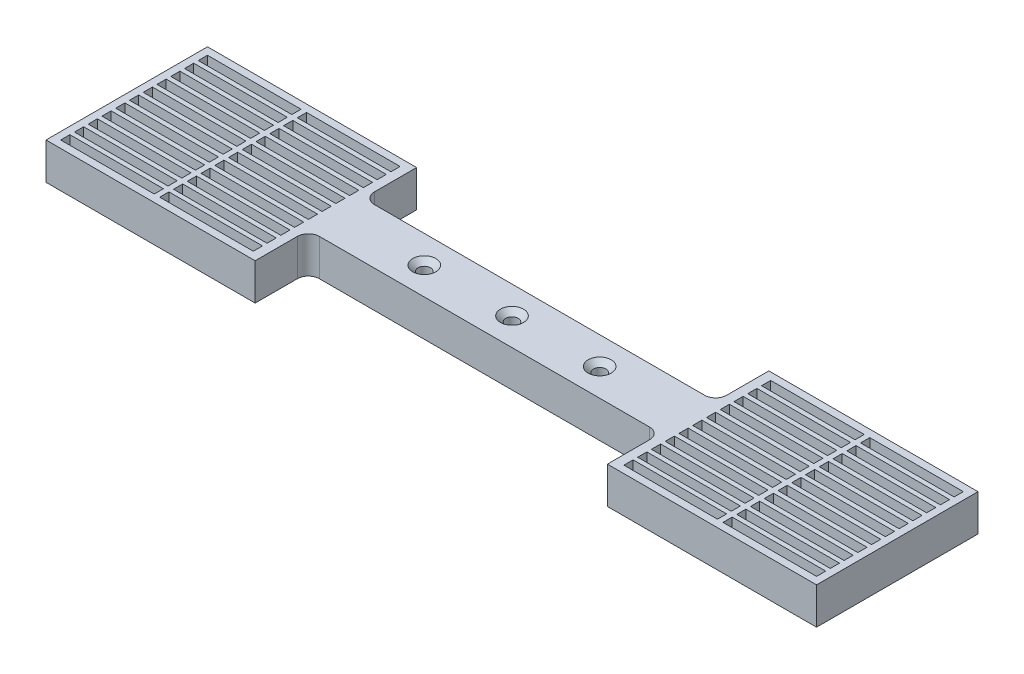
from build123d import *

# Parameters (mm, degrees)
BOSS_EXTRUDE1_DEPTH                             = 10
CUT_EXTRUDE1_REACH                              = 109.745
SKETCH2_W                                       = 25.5
SKETCH2_H                                       = 2.5
LPATTERN1_COUNT                                 = 6
LPATTERN1_PITCH                                 = 3.75
LPATTERN1_COL_COUNT                             = 6
LPATTERN1_COL_PITCH                             = 3.75
LPATTERN2_COUNT                                 = 2
LPATTERN2_PITCH                                 = 27
LPATTERN2_COPY_1_REACH                          = 109.745
LPATTERN2_COPY_1_SKETCH_W                       = 25.5
LPATTERN2_COPY_1_SKETCH_H                       = 2.5
LPATTERN2_COPY_2_REACH                          = 109.745
LPATTERN2_COPY_2_SKETCH_W                       = 25.5
LPATTERN2_COPY_2_SKETCH_H                       = 2.5
LPATTERN2_COPY_3_REACH                          = 109.745
LPATTERN2_COPY_3_SKETCH_W                       = 25.5
LPATTERN2_COPY_3_SKETCH_H                       = 2.5
LPATTERN2_COPY_4_REACH                          = 109.745
LPATTERN2_COPY_4_SKETCH_W                       = 25.5
LPATTERN2_COPY_4_SKETCH_H                       = 2.5
LPATTERN2_COPY_5_REACH                          = 109.745
LPATTERN2_COPY_5_SKETCH_W                       = 25.5
LPATTERN2_COPY_5_SKETCH_H                       = 2.5
LPATTERN2_COPY_6_REACH                          = 109.745
LPATTERN2_COPY_6_SKETCH_W                       = 25.5
LPATTERN2_COPY_6_SKETCH_H                       = 2.5
LPATTERN2_COPY_7_REACH                          = 109.745
LPATTERN2_COPY_7_SKETCH_W                       = 25.5
LPATTERN2_COPY_7_SKETCH_H                       = 2.5
LPATTERN2_COPY_8_REACH                          = 109.745
LPATTERN2_COPY_8_SKETCH_W                       = 25.5
LPATTERN2_COPY_8_SKETCH_H                       = 2.5
LPATTERN2_COPY_9_REACH                          = 109.745
LPATTERN2_COPY_9_SKETCH_W                       = 25.5
LPATTERN2_COPY_9_SKETCH_H                       = 2.5
LPATTERN2_COPY_10_REACH                         = 109.745
LPATTERN2_COPY_10_SKETCH_W                      = 25.5
LPATTERN2_COPY_10_SKETCH_H                      = 2.5
CSK_FOR_M3_FLAT_HEAD_MACHINE_SCREW1_D           = 3.4
CSK_FOR_M3_FLAT_HEAD_MACHINE_SCREW1_CSINK_D     = 6.3
CSK_FOR_M3_FLAT_HEAD_MACHINE_SCREW1_CSINK_ANGLE = 90
MIRROR1_COPY_1_REACH                            = 109.745
MIRROR1_COPY_1_SKETCH_W                         = 25.5
MIRROR1_COPY_1_SKETCH_H                         = 2.5
MIRROR1_COPY_2_REACH                            = 109.745
MIRROR1_COPY_2_SKETCH_W                         = 25.5
MIRROR1_COPY_2_SKETCH_H                         = 2.5
MIRROR1_COPY_3_REACH                            = 109.745
MIRROR1_COPY_3_SKETCH_W                         = 25.5
MIRROR1_COPY_3_SKETCH_H                         = 2.5
MIRROR1_COPY_4_REACH                            = 109.745
MIRROR1_COPY_4_SKETCH_W                         = 25.5
MIRROR1_COPY_4_SKETCH_H                         = 2.5
MIRROR1_COPY_5_REACH                            = 109.745
MIRROR1_COPY_5_SKETCH_W                         = 25.5
MIRROR1_COPY_5_SKETCH_H                         = 2.5
MIRROR1_COPY_6_REACH                            = 109.745
MIRROR1_COPY_6_SKETCH_W                         = 25.5
MIRROR1_COPY_6_SKETCH_H                         = 2.5
MIRROR1_COPY_7_REACH                            = 109.745
MIRROR1_COPY_7_SKETCH_W                         = 25.5
MIRROR1_COPY_7_SKETCH_H                         = 2.5
MIRROR1_COPY_8_REACH                            = 109.745
MIRROR1_COPY_8_SKETCH_W                         = 25.5
MIRROR1_COPY_8_SKETCH_H                         = 2.5
MIRROR1_COPY_9_REACH                            = 109.745
MIRROR1_COPY_9_SKETCH_W                         = 25.5
MIRROR1_COPY_9_SKETCH_H                         = 2.5
MIRROR1_COPY_10_REACH                           = 109.745
MIRROR1_COPY_10_SKETCH_W                        = 25.5
MIRROR1_COPY_10_SKETCH_H                        = 2.5
MIRROR1_COPY_11_REACH                           = 109.745
MIRROR1_COPY_11_SKETCH_W                        = 25.5
MIRROR1_COPY_11_SKETCH_H                        = 2.5
MIRROR1_COPY_12_REACH                           = 109.745
MIRROR1_COPY_12_SKETCH_W                        = 25.5
MIRROR1_COPY_12_SKETCH_H                        = 2.5
MIRROR1_COPY_13_REACH                           = 109.745
MIRROR1_COPY_13_SKETCH_W                        = 25.5
MIRROR1_COPY_13_SKETCH_H                        = 2.5
MIRROR1_COPY_14_REACH                           = 109.745
MIRROR1_COPY_14_SKETCH_W                        = 25.5
MIRROR1_COPY_14_SKETCH_H                        = 2.5
MIRROR1_COPY_15_REACH                           = 109.745
MIRROR1_COPY_15_SKETCH_W                        = 25.5
MIRROR1_COPY_15_SKETCH_H                        = 2.5
MIRROR1_COPY_16_REACH                           = 109.745
MIRROR1_COPY_16_SKETCH_W                        = 25.5
MIRROR1_COPY_16_SKETCH_H                        = 2.5
MIRROR1_COPY_17_REACH                           = 109.745
MIRROR1_COPY_17_SKETCH_W                        = 25.5
MIRROR1_COPY_17_SKETCH_H                        = 2.5
MIRROR1_COPY_18_REACH                           = 109.745
MIRROR1_COPY_18_SKETCH_W                        = 25.5
MIRROR1_COPY_18_SKETCH_H                        = 2.5
MIRROR1_COPY_19_REACH                           = 109.745
MIRROR1_COPY_19_SKETCH_W                        = 25.5
MIRROR1_COPY_19_SKETCH_H                        = 2.5
MIRROR1_COPY_20_REACH                           = 109.745
MIRROR1_COPY_20_SKETCH_W                        = 25.5
MIRROR1_COPY_20_SKETCH_H                        = 2.5
MIRROR1_COPY_21_REACH                           = 109.745
MIRROR1_COPY_21_SKETCH_W                        = 25.5
MIRROR1_COPY_21_SKETCH_H                        = 2.5
FILLET1_R                                       = 3


with BuildPart() as part:
    # Sketch1 → Boss-Extrude1 (new body)
    with BuildSketch(Plane(origin=(0, 0, 0), x_dir=(1, 0, 0), z_dir=(0, 1, 0))):
        Polygon((-105, -22), (-48, -22), (-48, -7.5), (48, -7.5), (48, -22), (105, -22), (105, 22), (48, 22), (48, 7.5), (-48, 7.5), (-48, 22), (-105, 22), align=None)
    extrude(amount=-BOSS_EXTRUDE1_DEPTH)

    # Sketch2 → Cut-Extrude1 (cut, up to next)
    with BuildSketch(Plane(origin=(0, 0, 0), x_dir=(1, 0, 0), z_dir=(0, 1, 0)), mode=Mode.PRIVATE) as cut_extrude1_sk1:
        with Locations((90.25, 0)):
            Rectangle(SKETCH2_W, SKETCH2_H)
    cut_extrude1_tool1 = extrude(cut_extrude1_sk1.sketch, amount=-CUT_EXTRUDE1_REACH, mode=Mode.PRIVATE) & part.part
    cut_extrude1 = cut_extrude1_tool1.solids().sort_by_distance((90.25, 0, 0))[0]
    add(cut_extrude1, mode=Mode.SUBTRACT)

    # LPattern1: Cut-Extrude1 ×6
    with Locations(*[(0, 0, -i * LPATTERN1_PITCH) for i in range(1, LPATTERN1_COUNT)]):
        add(cut_extrude1, mode=Mode.SUBTRACT)

    # LPattern1 col: Cut-Extrude1 ×6
    with Locations(*[(0, 0, i * LPATTERN1_COL_PITCH) for i in range(1, LPATTERN1_COL_COUNT)]):
        add(cut_extrude1, mode=Mode.SUBTRACT)

    # LPattern2: Cut-Extrude1 ×2
    with Locations(*[(-i * LPATTERN2_PITCH, 0, 0) for i in range(1, LPATTERN2_COUNT)]):
        add(cut_extrude1, mode=Mode.SUBTRACT)

    # LPattern2 copy 1 sketch → LPattern2 copy 1 (cut, up to next)
    with BuildSketch(Plane(origin=(-27, 0, -3.75), x_dir=(1, 0, 0), z_dir=(0, 1, 0)), mode=Mode.PRIVATE) as lpattern2_copy_1_sk1:
        with Locations((90.25, 0)):
            Rectangle(LPATTERN2_COPY_1_SKETCH_W, LPATTERN2_COPY_1_SKETCH_H)
    lpattern2_copy_1_tool1 = extrude(lpattern2_copy_1_sk1.sketch, amount=-LPATTERN2_COPY_1_REACH, mode=Mode.PRIVATE) & part.part
    add(lpattern2_copy_1_tool1.solids().sort_by_distance((63.25, 0, -3.75))[0], mode=Mode.SUBTRACT)

    # LPattern2 copy 2 sketch → LPattern2 copy 2 (cut, up to next)
    with BuildSketch(Plane(origin=(-27, 0, -7.5), x_dir=(1, 0, 0), z_dir=(0, 1, 0)), mode=Mode.PRIVATE) as lpattern2_copy_2_sk1:
        with Locations((90.25, 0)):
            Rectangle(LPATTERN2_COPY_2_SKETCH_W, LPATTERN2_COPY_2_SKETCH_H)
    lpattern2_copy_2_tool1 = extrude(lpattern2_copy_2_sk1.sketch, amount=-LPATTERN2_COPY_2_REACH, mode=Mode.PRIVATE) & part.part
    add(lpattern2_copy_2_tool1.solids().sort_by_distance((63.25, 0, -7.5))[0], mode=Mode.SUBTRACT)

    # LPattern2 copy 3 sketch → LPattern2 copy 3 (cut, up to next)
    with BuildSketch(Plane(origin=(-27, 0, -11.25), x_dir=(1, 0, 0), z_dir=(0, 1, 0)), mode=Mode.PRIVATE) as lpattern2_copy_3_sk1:
        with Locations((90.25, 0)):
            Rectangle(LPATTERN2_COPY_3_SKETCH_W, LPATTERN2_COPY_3_SKETCH_H)
    lpattern2_copy_3_tool1 = extrude(lpattern2_copy_3_sk1.sketch, amount=-LPATTERN2_COPY_3_REACH, mode=Mode.PRIVATE) & part.part
    add(lpattern2_copy_3_tool1.solids().sort_by_distance((63.25, 0, -11.25))[0], mode=Mode.SUBTRACT)

    # LPattern2 copy 4 sketch → LPattern2 copy 4 (cut, up to next)
    with BuildSketch(Plane(origin=(-27, 0, -15), x_dir=(1, 0, 0), z_dir=(0, 1, 0)), mode=Mode.PRIVATE) as lpattern2_copy_4_sk1:
        with Locations((90.25, 0)):
            Rectangle(LPATTERN2_COPY_4_SKETCH_W, LPATTERN2_COPY_4_SKETCH_H)
    lpattern2_copy_4_tool1 = extrude(lpattern2_copy_4_sk1.sketch, amount=-LPATTERN2_COPY_4_REACH, mode=Mode.PRIVATE) & part.part
    add(lpattern2_copy_4_tool1.solids().sort_by_distance((63.25, 0, -15))[0], mode=Mode.SUBTRACT)

    # LPattern2 copy 5 sketch → LPattern2 copy 5 (cut, up to next)
    with BuildSketch(Plane(origin=(-27, 0, -18.75), x_dir=(1, 0, 0), z_dir=(0, 1, 0)), mode=Mode.PRIVATE) as lpattern2_copy_5_sk1:
        with Locations((90.25, 0)):
            Rectangle(LPATTERN2_COPY_5_SKETCH_W, LPATTERN2_COPY_5_SKETCH_H)
    lpattern2_copy_5_tool1 = extrude(lpattern2_copy_5_sk1.sketch, amount=-LPATTERN2_COPY_5_REACH, mode=Mode.PRIVATE) & part.part
    add(lpattern2_copy_5_tool1.solids().sort_by_distance((63.25, 0, -18.75))[0], mode=Mode.SUBTRACT)

    # LPattern2 copy 6 sketch → LPattern2 copy 6 (cut, up to next)
    with BuildSketch(Plane(origin=(-27, 0, 3.75), x_dir=(1, 0, 0), z_dir=(0, 1, 0)), mode=Mode.PRIVATE) as lpattern2_copy_6_sk1:
        with Locations((90.25, 0)):
            Rectangle(LPATTERN2_COPY_6_SKETCH_W, LPATTERN2_COPY_6_SKETCH_H)
    lpattern2_copy_6_tool1 = extrude(lpattern2_copy_6_sk1.sketch, amount=-LPATTERN2_COPY_6_REACH, mode=Mode.PRIVATE) & part.part
    add(lpattern2_copy_6_tool1.solids().sort_by_distance((63.25, 0, 3.75))[0], mode=Mode.SUBTRACT)

    # LPattern2 copy 7 sketch → LPattern2 copy 7 (cut, up to next)
    with BuildSketch(Plane(origin=(-27, 0, 7.5), x_dir=(1, 0, 0), z_dir=(0, 1, 0)), mode=Mode.PRIVATE) as lpattern2_copy_7_sk1:
        with Locations((90.25, 0)):
            Rectangle(LPATTERN2_COPY_7_SKETCH_W, LPATTERN2_COPY_7_SKETCH_H)
    lpattern2_copy_7_tool1 = extrude(lpattern2_copy_7_sk1.sketch, amount=-LPATTERN2_COPY_7_REACH, mode=Mode.PRIVATE) & part.part
    add(lpattern2_copy_7_tool1.solids().sort_by_distance((63.25, 0, 7.5))[0], mode=Mode.SUBTRACT)

    # LPattern2 copy 8 sketch → LPattern2 copy 8 (cut, up to next)
    with BuildSketch(Plane(origin=(-27, 0, 11.25), x_dir=(1, 0, 0), z_dir=(0, 1, 0)), mode=Mode.PRIVATE) as lpattern2_copy_8_sk1:
        with Locations((90.25, 0)):
            Rectangle(LPATTERN2_COPY_8_SKETCH_W, LPATTERN2_COPY_8_SKETCH_H)
    lpattern2_copy_8_tool1 = extrude(lpattern2_copy_8_sk1.sketch, amount=-LPATTERN2_COPY_8_REACH, mode=Mode.PRIVATE) & part.part
    add(lpattern2_copy_8_tool1.solids().sort_by_distance((63.25, 0, 11.25))[0], mode=Mode.SUBTRACT)

    # LPattern2 copy 9 sketch → LPattern2 copy 9 (cut, up to next)
    with BuildSketch(Plane(origin=(-27, 0, 15), x_dir=(1, 0, 0), z_dir=(0, 1, 0)), mode=Mode.PRIVATE) as lpattern2_copy_9_sk1:
        with Locations((90.25, 0)):
            Rectangle(LPATTERN2_COPY_9_SKETCH_W, LPATTERN2_COPY_9_SKETCH_H)
    lpattern2_copy_9_tool1 = extrude(lpattern2_copy_9_sk1.sketch, amount=-LPATTERN2_COPY_9_REACH, mode=Mode.PRIVATE) & part.part
    add(lpattern2_copy_9_tool1.solids().sort_by_distance((63.25, 0, 15))[0], mode=Mode.SUBTRACT)

    # LPattern2 copy 10 sketch → LPattern2 copy 10 (cut, up to next)
    with BuildSketch(Plane(origin=(-27, 0, 18.75), x_dir=(1, 0, 0), z_dir=(0, 1, 0)), mode=Mode.PRIVATE) as lpattern2_copy_10_sk1:
        with Locations((90.25, 0)):
            Rectangle(LPATTERN2_COPY_10_SKETCH_W, LPATTERN2_COPY_10_SKETCH_H)
    lpattern2_copy_10_tool1 = extrude(lpattern2_copy_10_sk1.sketch, amount=-LPATTERN2_COPY_10_REACH, mode=Mode.PRIVATE) & part.part
    add(lpattern2_copy_10_tool1.solids().sort_by_distance((63.25, 0, 18.75))[0], mode=Mode.SUBTRACT)

    # CSK for M3 Flat Head Machine Screw1 (through all)
    with Locations(Plane(origin=(23.9, 0, 0), x_dir=(0, 0, 1), z_dir=(0, 1, 0))):
        with Locations((0, 0), (0, -47.8), (0, -23.9)):
            CounterSinkHole(CSK_FOR_M3_FLAT_HEAD_MACHINE_SCREW1_D / 2, CSK_FOR_M3_FLAT_HEAD_MACHINE_SCREW1_CSINK_D / 2, counter_sink_angle=CSK_FOR_M3_FLAT_HEAD_MACHINE_SCREW1_CSINK_ANGLE)

    # Mirror1: Cut-Extrude1 across plane
    add(cut_extrude1.mirror(Plane(origin=(0, 0, 0), x_dir=(0, 0, 1), z_dir=(1, 0, 0))), mode=Mode.SUBTRACT)

    # Mirror1 copy 1 sketch → Mirror1 copy 1 (cut, up to next)
    with BuildSketch(Plane(origin=(0, 0, -3.75), x_dir=(-1, 0, 0), z_dir=(0, 1, 0)), mode=Mode.PRIVATE) as mirror1_copy_1_sk1:
        with Locations((90.25, 0)):
            Rectangle(MIRROR1_COPY_1_SKETCH_W, MIRROR1_COPY_1_SKETCH_H)
    mirror1_copy_1_tool1 = extrude(mirror1_copy_1_sk1.sketch, amount=-MIRROR1_COPY_1_REACH, mode=Mode.PRIVATE) & part.part
    add(mirror1_copy_1_tool1.solids().sort_by_distance((-90.25, 0, -3.75))[0], mode=Mode.SUBTRACT)

    # Mirror1 copy 2 sketch → Mirror1 copy 2 (cut, up to next)
    with BuildSketch(Plane(origin=(0, 0, -7.5), x_dir=(-1, 0, 0), z_dir=(0, 1, 0)), mode=Mode.PRIVATE) as mirror1_copy_2_sk1:
        with Locations((90.25, 0)):
            Rectangle(MIRROR1_COPY_2_SKETCH_W, MIRROR1_COPY_2_SKETCH_H)
    mirror1_copy_2_tool1 = extrude(mirror1_copy_2_sk1.sketch, amount=-MIRROR1_COPY_2_REACH, mode=Mode.PRIVATE) & part.part
    add(mirror1_copy_2_tool1.solids().sort_by_distance((-90.25, 0, -7.5))[0], mode=Mode.SUBTRACT)

    # Mirror1 copy 3 sketch → Mirror1 copy 3 (cut, up to next)
    with BuildSketch(Plane(origin=(0, 0, -11.25), x_dir=(-1, 0, 0), z_dir=(0, 1, 0)), mode=Mode.PRIVATE) as mirror1_copy_3_sk1:
        with Locations((90.25, 0)):
            Rectangle(MIRROR1_COPY_3_SKETCH_W, MIRROR1_COPY_3_SKETCH_H)
    mirror1_copy_3_tool1 = extrude(mirror1_copy_3_sk1.sketch, amount=-MIRROR1_COPY_3_REACH, mode=Mode.PRIVATE) & part.part
    add(mirror1_copy_3_tool1.solids().sort_by_distance((-90.25, 0, -11.25))[0], mode=Mode.SUBTRACT)

    # Mirror1 copy 4 sketch → Mirror1 copy 4 (cut, up to next)
    with BuildSketch(Plane(origin=(0, 0, -15), x_dir=(-1, 0, 0), z_dir=(0, 1, 0)), mode=Mode.PRIVATE) as mirror1_copy_4_sk1:
        with Locations((90.25, 0)):
            Rectangle(MIRROR1_COPY_4_SKETCH_W, MIRROR1_COPY_4_SKETCH_H)
    mirror1_copy_4_tool1 = extrude(mirror1_copy_4_sk1.sketch, amount=-MIRROR1_COPY_4_REACH, mode=Mode.PRIVATE) & part.part
    add(mirror1_copy_4_tool1.solids().sort_by_distance((-90.25, 0, -15))[0], mode=Mode.SUBTRACT)

    # Mirror1 copy 5 sketch → Mirror1 copy 5 (cut, up to next)
    with BuildSketch(Plane(origin=(0, 0, -18.75), x_dir=(-1, 0, 0), z_dir=(0, 1, 0)), mode=Mode.PRIVATE) as mirror1_copy_5_sk1:
        with Locations((90.25, 0)):
            Rectangle(MIRROR1_COPY_5_SKETCH_W, MIRROR1_COPY_5_SKETCH_H)
    mirror1_copy_5_tool1 = extrude(mirror1_copy_5_sk1.sketch, amount=-MIRROR1_COPY_5_REACH, mode=Mode.PRIVATE) & part.part
    add(mirror1_copy_5_tool1.solids().sort_by_distance((-90.25, 0, -18.75))[0], mode=Mode.SUBTRACT)

    # Mirror1 copy 6 sketch → Mirror1 copy 6 (cut, up to next)
    with BuildSketch(Plane(origin=(0, 0, 3.75), x_dir=(-1, 0, 0), z_dir=(0, 1, 0)), mode=Mode.PRIVATE) as mirror1_copy_6_sk1:
        with Locations((90.25, 0)):
            Rectangle(MIRROR1_COPY_6_SKETCH_W, MIRROR1_COPY_6_SKETCH_H)
    mirror1_copy_6_tool1 = extrude(mirror1_copy_6_sk1.sketch, amount=-MIRROR1_COPY_6_REACH, mode=Mode.PRIVATE) & part.part
    add(mirror1_copy_6_tool1.solids().sort_by_distance((-90.25, 0, 3.75))[0], mode=Mode.SUBTRACT)

    # Mirror1 copy 7 sketch → Mirror1 copy 7 (cut, up to next)
    with BuildSketch(Plane(origin=(0, 0, 7.5), x_dir=(-1, 0, 0), z_dir=(0, 1, 0)), mode=Mode.PRIVATE) as mirror1_copy_7_sk1:
        with Locations((90.25, 0)):
            Rectangle(MIRROR1_COPY_7_SKETCH_W, MIRROR1_COPY_7_SKETCH_H)
    mirror1_copy_7_tool1 = extrude(mirror1_copy_7_sk1.sketch, amount=-MIRROR1_COPY_7_REACH, mode=Mode.PRIVATE) & part.part
    add(mirror1_copy_7_tool1.solids().sort_by_distance((-90.25, 0, 7.5))[0], mode=Mode.SUBTRACT)

    # Mirror1 copy 8 sketch → Mirror1 copy 8 (cut, up to next)
    with BuildSketch(Plane(origin=(0, 0, 11.25), x_dir=(-1, 0, 0), z_dir=(0, 1, 0)), mode=Mode.PRIVATE) as mirror1_copy_8_sk1:
        with Locations((90.25, 0)):
            Rectangle(MIRROR1_COPY_8_SKETCH_W, MIRROR1_COPY_8_SKETCH_H)
    mirror1_copy_8_tool1 = extrude(mirror1_copy_8_sk1.sketch, amount=-MIRROR1_COPY_8_REACH, mode=Mode.PRIVATE) & part.part
    add(mirror1_copy_8_tool1.solids().sort_by_distance((-90.25, 0, 11.25))[0], mode=Mode.SUBTRACT)

    # Mirror1 copy 9 sketch → Mirror1 copy 9 (cut, up to next)
    with BuildSketch(Plane(origin=(0, 0, 15), x_dir=(-1, 0, 0), z_dir=(0, 1, 0)), mode=Mode.PRIVATE) as mirror1_copy_9_sk1:
        with Locations((90.25, 0)):
            Rectangle(MIRROR1_COPY_9_SKETCH_W, MIRROR1_COPY_9_SKETCH_H)
    mirror1_copy_9_tool1 = extrude(mirror1_copy_9_sk1.sketch, amount=-MIRROR1_COPY_9_REACH, mode=Mode.PRIVATE) & part.part
    add(mirror1_copy_9_tool1.solids().sort_by_distance((-90.25, 0, 15))[0], mode=Mode.SUBTRACT)

    # Mirror1 copy 10 sketch → Mirror1 copy 10 (cut, up to next)
    with BuildSketch(Plane(origin=(0, 0, 18.75), x_dir=(-1, 0, 0), z_dir=(0, 1, 0)), mode=Mode.PRIVATE) as mirror1_copy_10_sk1:
        with Locations((90.25, 0)):
            Rectangle(MIRROR1_COPY_10_SKETCH_W, MIRROR1_COPY_10_SKETCH_H)
    mirror1_copy_10_tool1 = extrude(mirror1_copy_10_sk1.sketch, amount=-MIRROR1_COPY_10_REACH, mode=Mode.PRIVATE) & part.part
    add(mirror1_copy_10_tool1.solids().sort_by_distance((-90.25, 0, 18.75))[0], mode=Mode.SUBTRACT)

    # Mirror1 copy 11 sketch → Mirror1 copy 11 (cut, up to next)
    with BuildSketch(Plane(origin=(27, 0, 0), x_dir=(-1, 0, 0), z_dir=(0, 1, 0)), mode=Mode.PRIVATE) as mirror1_copy_11_sk1:
        with Locations((90.25, 0)):
            Rectangle(MIRROR1_COPY_11_SKETCH_W, MIRROR1_COPY_11_SKETCH_H)
    mirror1_copy_11_tool1 = extrude(mirror1_copy_11_sk1.sketch, amount=-MIRROR1_COPY_11_REACH, mode=Mode.PRIVATE) & part.part
    add(mirror1_copy_11_tool1.solids().sort_by_distance((-63.25, 0, 0))[0], mode=Mode.SUBTRACT)

    # Mirror1 copy 12 sketch → Mirror1 copy 12 (cut, up to next)
    with BuildSketch(Plane(origin=(27, 0, -3.75), x_dir=(-1, 0, 0), z_dir=(0, 1, 0)), mode=Mode.PRIVATE) as mirror1_copy_12_sk1:
        with Locations((90.25, 0)):
            Rectangle(MIRROR1_COPY_12_SKETCH_W, MIRROR1_COPY_12_SKETCH_H)
    mirror1_copy_12_tool1 = extrude(mirror1_copy_12_sk1.sketch, amount=-MIRROR1_COPY_12_REACH, mode=Mode.PRIVATE) & part.part
    add(mirror1_copy_12_tool1.solids().sort_by_distance((-63.25, 0, -3.75))[0], mode=Mode.SUBTRACT)

    # Mirror1 copy 13 sketch → Mirror1 copy 13 (cut, up to next)
    with BuildSketch(Plane(origin=(27, 0, -7.5), x_dir=(-1, 0, 0), z_dir=(0, 1, 0)), mode=Mode.PRIVATE) as mirror1_copy_13_sk1:
        with Locations((90.25, 0)):
            Rectangle(MIRROR1_COPY_13_SKETCH_W, MIRROR1_COPY_13_SKETCH_H)
    mirror1_copy_13_tool1 = extrude(mirror1_copy_13_sk1.sketch, amount=-MIRROR1_COPY_13_REACH, mode=Mode.PRIVATE) & part.part
    add(mirror1_copy_13_tool1.solids().sort_by_distance((-63.25, 0, -7.5))[0], mode=Mode.SUBTRACT)

    # Mirror1 copy 14 sketch → Mirror1 copy 14 (cut, up to next)
    with BuildSketch(Plane(origin=(27, 0, -11.25), x_dir=(-1, 0, 0), z_dir=(0, 1, 0)), mode=Mode.PRIVATE) as mirror1_copy_14_sk1:
        with Locations((90.25, 0)):
            Rectangle(MIRROR1_COPY_14_SKETCH_W, MIRROR1_COPY_14_SKETCH_H)
    mirror1_copy_14_tool1 = extrude(mirror1_copy_14_sk1.sketch, amount=-MIRROR1_COPY_14_REACH, mode=Mode.PRIVATE) & part.part
    add(mirror1_copy_14_tool1.solids().sort_by_distance((-63.25, 0, -11.25))[0], mode=Mode.SUBTRACT)

    # Mirror1 copy 15 sketch → Mirror1 copy 15 (cut, up to next)
    with BuildSketch(Plane(origin=(27, 0, -15), x_dir=(-1, 0, 0), z_dir=(0, 1, 0)), mode=Mode.PRIVATE) as mirror1_copy_15_sk1:
        with Locations((90.25, 0)):
            Rectangle(MIRROR1_COPY_15_SKETCH_W, MIRROR1_COPY_15_SKETCH_H)
    mirror1_copy_15_tool1 = extrude(mirror1_copy_15_sk1.sketch, amount=-MIRROR1_COPY_15_REACH, mode=Mode.PRIVATE) & part.part
    add(mirror1_copy_15_tool1.solids().sort_by_distance((-63.25, 0, -15))[0], mode=Mode.SUBTRACT)

    # Mirror1 copy 16 sketch → Mirror1 copy 16 (cut, up to next)
    with BuildSketch(Plane(origin=(27, 0, -18.75), x_dir=(-1, 0, 0), z_dir=(0, 1, 0)), mode=Mode.PRIVATE) as mirror1_copy_16_sk1:
        with Locations((90.25, 0)):
            Rectangle(MIRROR1_COPY_16_SKETCH_W, MIRROR1_COPY_16_SKETCH_H)
    mirror1_copy_16_tool1 = extrude(mirror1_copy_16_sk1.sketch, amount=-MIRROR1_COPY_16_REACH, mode=Mode.PRIVATE) & part.part
    add(mirror1_copy_16_tool1.solids().sort_by_distance((-63.25, 0, -18.75))[0], mode=Mode.SUBTRACT)

    # Mirror1 copy 17 sketch → Mirror1 copy 17 (cut, up to next)
    with BuildSketch(Plane(origin=(27, 0, 3.75), x_dir=(-1, 0, 0), z_dir=(0, 1, 0)), mode=Mode.PRIVATE) as mirror1_copy_17_sk1:
        with Locations((90.25, 0)):
            Rectangle(MIRROR1_COPY_17_SKETCH_W, MIRROR1_COPY_17_SKETCH_H)
    mirror1_copy_17_tool1 = extrude(mirror1_copy_17_sk1.sketch, amount=-MIRROR1_COPY_17_REACH, mode=Mode.PRIVATE) & part.part
    add(mirror1_copy_17_tool1.solids().sort_by_distance((-63.25, 0, 3.75))[0], mode=Mode.SUBTRACT)

    # Mirror1 copy 18 sketch → Mirror1 copy 18 (cut, up to next)
    with BuildSketch(Plane(origin=(27, 0, 7.5), x_dir=(-1, 0, 0), z_dir=(0, 1, 0)), mode=Mode.PRIVATE) as mirror1_copy_18_sk1:
        with Locations((90.25, 0)):
            Rectangle(MIRROR1_COPY_18_SKETCH_W, MIRROR1_COPY_18_SKETCH_H)
    mirror1_copy_18_tool1 = extrude(mirror1_copy_18_sk1.sketch, amount=-MIRROR1_COPY_18_REACH, mode=Mode.PRIVATE) & part.part
    add(mirror1_copy_18_tool1.solids().sort_by_distance((-63.25, 0, 7.5))[0], mode=Mode.SUBTRACT)

    # Mirror1 copy 19 sketch → Mirror1 copy 19 (cut, up to next)
    with BuildSketch(Plane(origin=(27, 0, 11.25), x_dir=(-1, 0, 0), z_dir=(0, 1, 0)), mode=Mode.PRIVATE) as mirror1_copy_19_sk1:
        with Locations((90.25, 0)):
            Rectangle(MIRROR1_COPY_19_SKETCH_W, MIRROR1_COPY_19_SKETCH_H)
    mirror1_copy_19_tool1 = extrude(mirror1_copy_19_sk1.sketch, amount=-MIRROR1_COPY_19_REACH, mode=Mode.PRIVATE) & part.part
    add(mirror1_copy_19_tool1.solids().sort_by_distance((-63.25, 0, 11.25))[0], mode=Mode.SUBTRACT)

    # Mirror1 copy 20 sketch → Mirror1 copy 20 (cut, up to next)
    with BuildSketch(Plane(origin=(27, 0, 15), x_dir=(-1, 0, 0), z_dir=(0, 1, 0)), mode=Mode.PRIVATE) as mirror1_copy_20_sk1:
        with Locations((90.25, 0)):
            Rectangle(MIRROR1_COPY_20_SKETCH_W, MIRROR1_COPY_20_SKETCH_H)
    mirror1_copy_20_tool1 = extrude(mirror1_copy_20_sk1.sketch, amount=-MIRROR1_COPY_20_REACH, mode=Mode.PRIVATE) & part.part
    add(mirror1_copy_20_tool1.solids().sort_by_distance((-63.25, 0, 15))[0], mode=Mode.SUBTRACT)

    # Mirror1 copy 21 sketch → Mirror1 copy 21 (cut, up to next)
    with BuildSketch(Plane(origin=(27, 0, 18.75), x_dir=(-1, 0, 0), z_dir=(0, 1, 0)), mode=Mode.PRIVATE) as mirror1_copy_21_sk1:
        with Locations((90.25, 0)):
            Rectangle(MIRROR1_COPY_21_SKETCH_W, MIRROR1_COPY_21_SKETCH_H)
    mirror1_copy_21_tool1 = extrude(mirror1_copy_21_sk1.sketch, amount=-MIRROR1_COPY_21_REACH, mode=Mode.PRIVATE) & part.part
    add(mirror1_copy_21_tool1.solids().sort_by_distance((-63.25, 0, 18.75))[0], mode=Mode.SUBTRACT)

    # Fillet1
    fillet1_edges = [part.edges().sort_by_distance(p)[0] for p in [
        (-48, -5, -7.5),
        (48, -5, -7.5),
        (48, -5, 7.5),
        (-48, -5, 7.5),
    ]]
    fillet(fillet1_edges, radius=FILLET1_R)


solid = part.part
